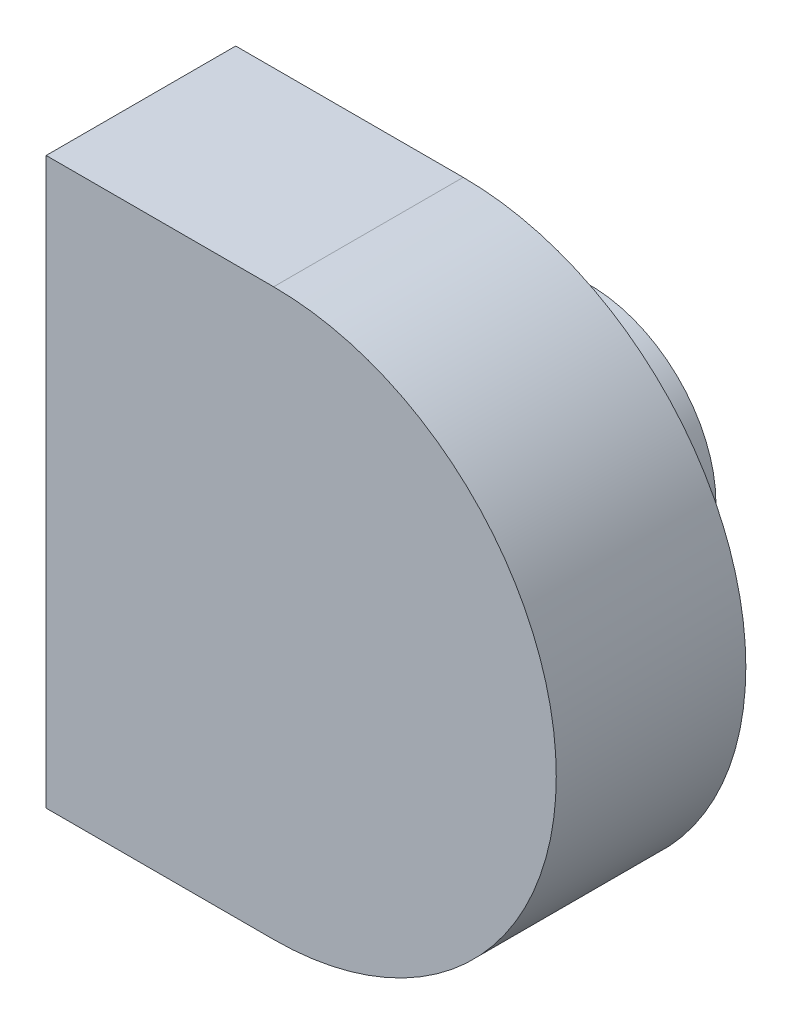
from build123d import *

# Parameters (mm, degrees)
SKETCH_1_W          = 189.06
SKETCH_1_H          = 44.73
EXTRUDE_1_DEPTH     = 15
CUT_EXTRUDE_4_REACH = 196.858
SKETCH_6_R          = 10
EXTRUDE_2_DEPTH     = 10
SKETCH_7_R          = 1
CUT_EXTRUDE_6_DEPTH = 5
SKETCH_8_R          = 12
SKETCH_8_R_2        = 10
EXTRUDE_3_DEPTH     = 2.5


with BuildPart() as part:
    # 草图1 → 凸台-拉伸1 (new body)
    with BuildSketch(Plane.XY):
        with Locations((94.53, 22.365)):
            Rectangle(SKETCH_1_W, SKETCH_1_H)
    extrude(amount=EXTRUDE_1_DEPTH)

    # 草图4 → 切除-拉伸4 (cut, up to next)
    with BuildSketch(Plane.XY.offset(15), mode=Mode.PRIVATE) as cut_extrude_4_sk1:
        with BuildLine():
            Line((189.06, 44.73), (18, 44.73))
            ThreePointArc((18, 44.73), (40.365, 22.365), (18, 0))
            Line((18, 0), (189.06, 0))
            Line((189.06, 0), (189.06, 44.73))
        make_face()
    cut_extrude_4_tool1 = extrude(cut_extrude_4_sk1.sketch, amount=-CUT_EXTRUDE_4_REACH, mode=Mode.PRIVATE) & part.part
    add(cut_extrude_4_tool1.solids().sort_by_distance((112.231547, 22.365, 15))[0], mode=Mode.SUBTRACT)

    # 草图6 → 凸台-拉伸2 (add)
    with BuildSketch(Plane(origin=(0, 0, 0), x_dir=(-1, 0, 0), z_dir=(0, 0, -1))):
        with Locations((-18, 22.365)):
            Circle(SKETCH_6_R)
    extrude(amount=EXTRUDE_2_DEPTH)

    # 草图7 → 切除-拉伸6 (cut)
    with BuildSketch(Plane(origin=(0, 0, -10), x_dir=(-1, 0, 0), z_dir=(0, 0, -1))):
        with Locations((-18, 29.365)):
            Circle(SKETCH_7_R)
        with Locations((-11, 22.365)):
            Circle(SKETCH_7_R)
        with Locations((-18, 15.365)):
            Circle(SKETCH_7_R)
        with Locations((-25, 22.365)):
            Circle(SKETCH_7_R)
    extrude(amount=-CUT_EXTRUDE_6_DEPTH, mode=Mode.SUBTRACT)

    # 草图8 → 凸台-拉伸3 (add)
    with BuildSketch(Plane(origin=(0, 0, 0), x_dir=(-1, 0, 0), z_dir=(0, 0, -1))):
        with Locations((-18, 22.365)):
            Circle(SKETCH_8_R)
        with Locations((-18, 22.365)):
            Circle(SKETCH_8_R_2, mode=Mode.SUBTRACT)
    extrude(amount=EXTRUDE_3_DEPTH)


solid = part.part
